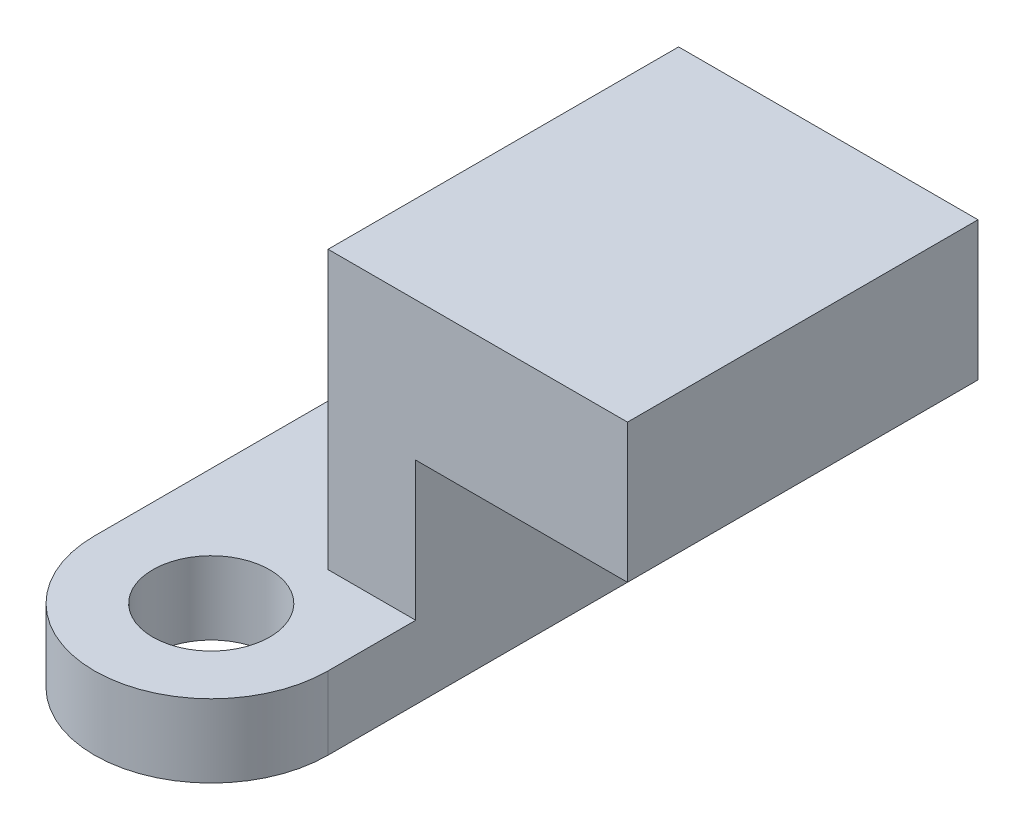
from build123d import *

# Parameters (mm, degrees)
SKETCH2_R                = 8
BOSS_EXTRUDE1_DEPTH      = 10
BOSS_EXTRUDE2_DEPTH      = 24
BOSS_EXTRUDE2_DEPTH_BACK = 24


with BuildPart() as part:
    # Sketch2 → Boss-Extrude1 (new body)
    with BuildSketch(Plane(origin=(0, 0, 0), x_dir=(1, 0, 0), z_dir=(0, 1, 0))):
        with BuildLine():
            ThreePointArc((16, 36), (0, 52), (-16, 36))
            Line((-16, 36), (-16, -36))
            ThreePointArc((-16, -36), (0, -52), (16, -36))
            Line((16, -36), (16, 36))
        make_face()
        with Locations((0, 36)):
            Circle(SKETCH2_R, mode=Mode.SUBTRACT)
        with Locations((0, -36)):
            Circle(SKETCH2_R, mode=Mode.SUBTRACT)
    extrude(amount=BOSS_EXTRUDE1_DEPTH)

    # Sketch3 → Boss-Extrude2 (add, two sides: drawn at the far end of the back side and taken through both)
    with BuildSketch(Plane.XY.offset(-BOSS_EXTRUDE2_DEPTH_BACK)):
        Polygon((16, 10), (16, 29), (45, 29), (45, 48), (4, 48), (4, 10), align=None)
    extrude(amount=BOSS_EXTRUDE2_DEPTH + BOSS_EXTRUDE2_DEPTH_BACK)


solid = part.part
